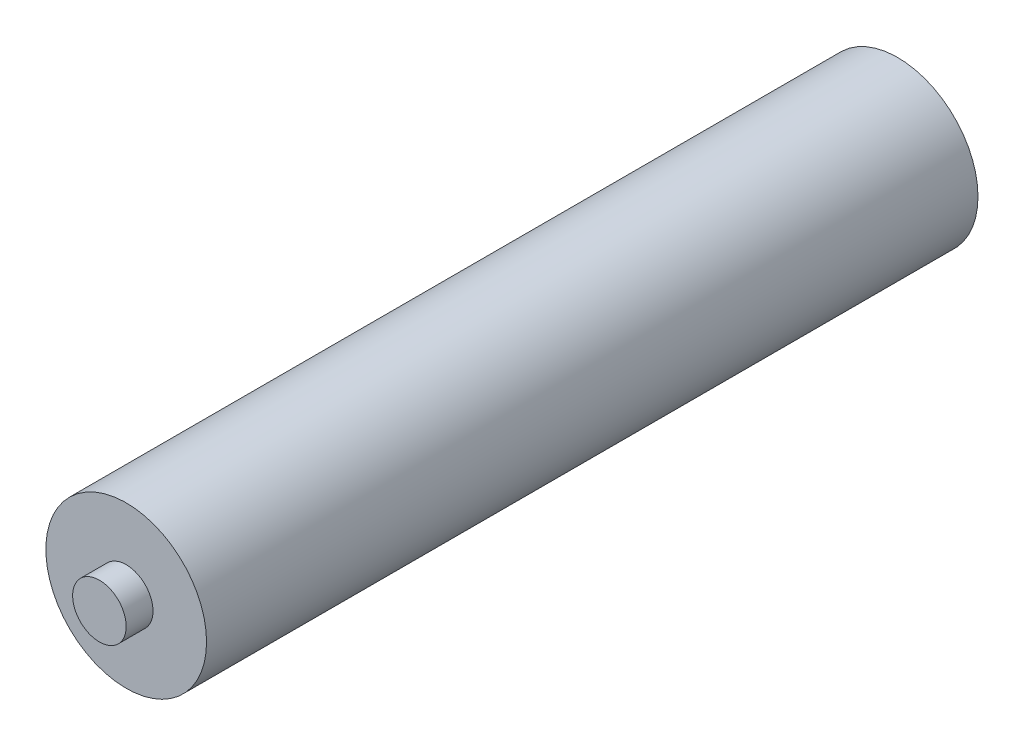
from build123d import *

# Parameters (mm, degrees)
SKETCH1_R           = 15
BOSS_EXTRUDE1_DEPTH = 144
SKETCH2_R           = 5
BOSS_EXTRUDE2_DEPTH = 5
BOSS_EXTRUDE3_START = 5
SKETCH3_R           = 5
BOSS_EXTRUDE3_DEPTH = 5


with BuildPart() as part:
    # Sketch1 → Boss-Extrude1 (new body)
    with BuildSketch(Plane.XY):
        Circle(SKETCH1_R)
    extrude(amount=BOSS_EXTRUDE1_DEPTH)

    # Sketch2 → Boss-Extrude2 (add)
    with BuildSketch(Plane.XY.offset(144)):
        Circle(SKETCH2_R)
    extrude(amount=BOSS_EXTRUDE2_DEPTH)

    # Sketch3 → Boss-Extrude3 (add)
    with BuildSketch(Plane(origin=(0, 0, 0), x_dir=(-1, 0, 0), z_dir=(0, 0, -1)).offset(BOSS_EXTRUDE3_START)):
        with Locations(Location((0, 0, 0), (0, 0, 180))):
            Circle(SKETCH3_R)
    extrude(amount=-BOSS_EXTRUDE3_DEPTH)


solid = part.part
